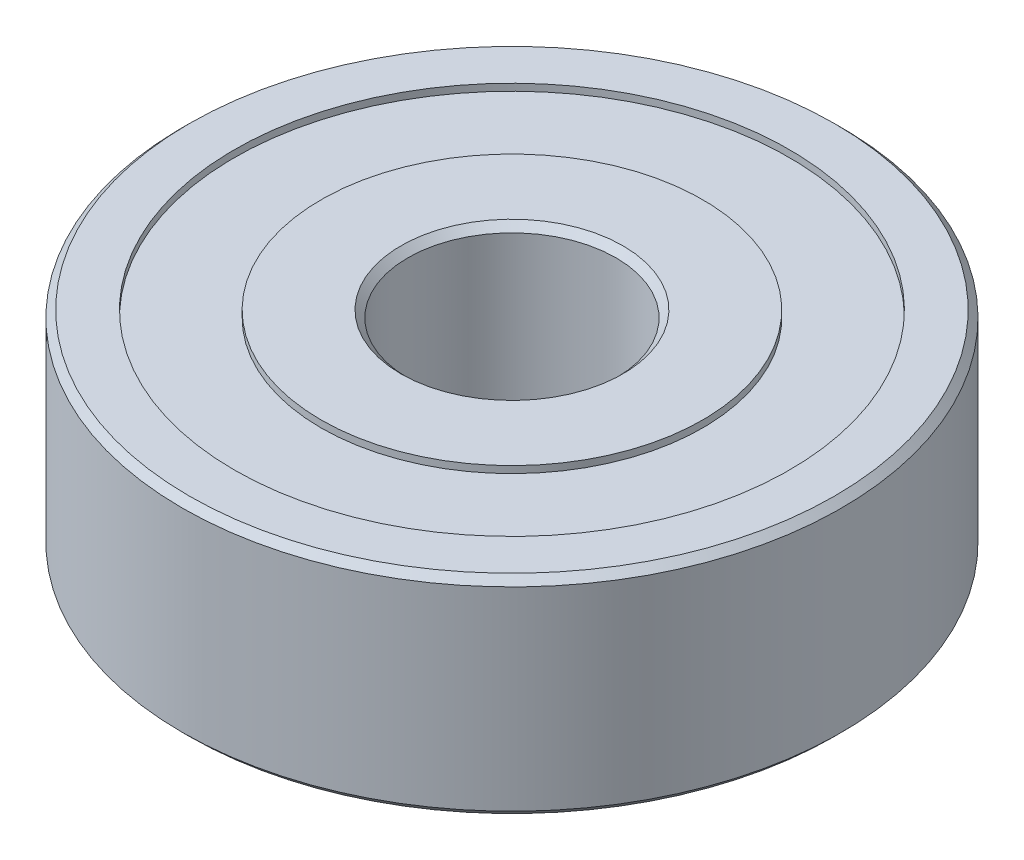
from build123d import *

# Parameters (mm, degrees)
SKETCH1_R           = 9.5
SKETCH1_R_2         = 3
BOSS_EXTRUDE1_DEPTH = 6
SKETCH2_R           = 8
SKETCH2_R_2         = 5.5
CUT_EXTRUDE1_DEPTH  = 0.2
CUT_EXTRUDE2_START  = -0.2
SKETCH3_R           = 8
SKETCH3_R_2         = 5.5
CUT_EXTRUDE2_DEPTH  = 0.2
CHAMFER1_SIZE       = 0.2


with BuildPart() as part:
    # Sketch1 → Boss-Extrude1 (new body)
    with BuildSketch(Plane(origin=(0, 0, 0), x_dir=(1, 0, 0), z_dir=(0, 1, 0))):
        with Locations(Location((0, 0, 0), (0, 0, 270))):
            Circle(SKETCH1_R)
        with Locations(Location((0, 0, 0), (0, 0, 270))):
            Circle(SKETCH1_R_2, mode=Mode.SUBTRACT)
    extrude(amount=BOSS_EXTRUDE1_DEPTH)

    # Sketch2 → Cut-Extrude1 (cut)
    with BuildSketch(Plane(origin=(0, 6, 0), x_dir=(1, 0, 0), z_dir=(0, 1, 0))):
        with Locations(Location((0, 0, 0), (0, 0, 270))):
            Circle(SKETCH2_R)
        with Locations(Location((0, 0, 0), (0, 0, 270))):
            Circle(SKETCH2_R_2, mode=Mode.SUBTRACT)
    extrude(amount=-CUT_EXTRUDE1_DEPTH, mode=Mode.SUBTRACT)

    # Sketch3 → Cut-Extrude2 (cut)
    with BuildSketch(Plane.XZ.offset(CUT_EXTRUDE2_START)):
        with Locations(Location((0, 0, 0), (0, 0, 90))):
            Circle(SKETCH3_R)
        with Locations(Location((0, 0, 0), (0, 0, 90))):
            Circle(SKETCH3_R_2, mode=Mode.SUBTRACT)
    extrude(amount=CUT_EXTRUDE2_DEPTH, mode=Mode.SUBTRACT)

    # Chamfer1
    chamfer1_edges = [part.edges().sort_by_distance(p)[0] for p in [
        (0, 0, -9.5),
        (0, 6, -9.5),
        (0, 0, -3),
        (0, 6, -3),
    ]]
    chamfer(chamfer1_edges, length=CHAMFER1_SIZE)


solid = part.part
